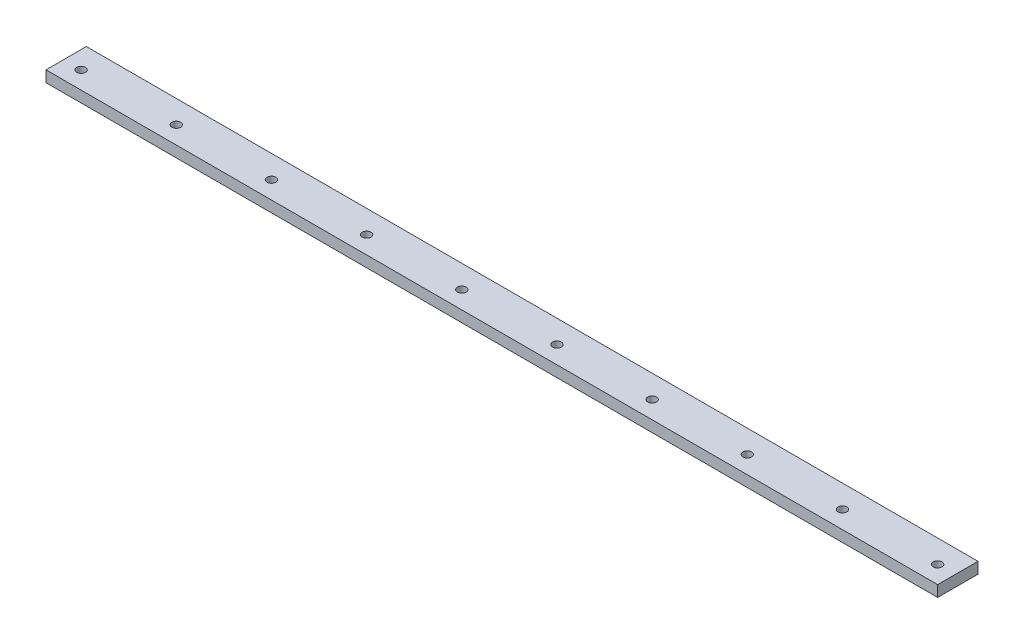
from build123d import *

# Parameters (mm, degrees)
SKETCH1_W           = 508
SKETCH1_H           = 23
SKETCH1_R           = 2.5
BOSS_EXTRUDE1_DEPTH = 3.175


with BuildPart() as part:
    # Sketch1 → Boss-Extrude1 (new, symmetric)
    with BuildSketch(Plane(origin=(0, 0, 0), x_dir=(1, 0, 0), z_dir=(0, 1, 0))):
        with Locations((0, 1.5)):
            Rectangle(SKETCH1_W, SKETCH1_H)
        with Locations(Location((-244, 0, 0), (0, 0, 270))):
            Circle(SKETCH1_R, mode=Mode.SUBTRACT)
        with Locations(Location((-189.777777778, 0, 0), (0, 0, 270))):
            Circle(SKETCH1_R, mode=Mode.SUBTRACT)
        with Locations(Location((-135.555555556, 0, 0), (0, 0, 270))):
            Circle(SKETCH1_R, mode=Mode.SUBTRACT)
        with Locations(Location((-81.333333333, 0, 0), (0, 0, 270))):
            Circle(SKETCH1_R, mode=Mode.SUBTRACT)
        with Locations(Location((-27.111111111, 0, 0), (0, 0, 270))):
            Circle(SKETCH1_R, mode=Mode.SUBTRACT)
        with Locations(Location((27.111111111, 0, 0), (0, 0, 270))):
            Circle(SKETCH1_R, mode=Mode.SUBTRACT)
        with Locations(Location((81.333333333, 0, 0), (0, 0, 270))):
            Circle(SKETCH1_R, mode=Mode.SUBTRACT)
        with Locations(Location((135.555555556, 0, 0), (0, 0, 270))):
            Circle(SKETCH1_R, mode=Mode.SUBTRACT)
        with Locations(Location((189.777777778, 0, 0), (0, 0, 270))):
            Circle(SKETCH1_R, mode=Mode.SUBTRACT)
        with Locations(Location((244, 0, 0), (0, 0, 270))):
            Circle(SKETCH1_R, mode=Mode.SUBTRACT)
    extrude(amount=BOSS_EXTRUDE1_DEPTH, both=True)


solid = part.part
